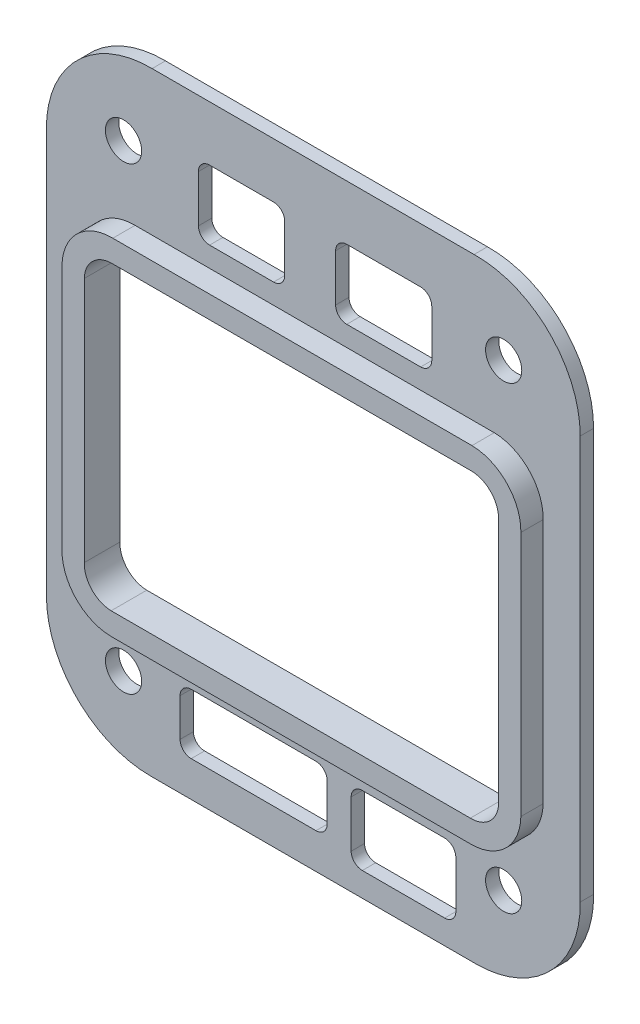
from build123d import *

# Parameters (mm, degrees)
MODEL_R         = 1.62599878
EXTRUDE_1_DEPTH = 1.2
EXTRUDE_2_DEPTH = 3.2


with BuildPart() as part:
    # Model → 凸台-拉伸1 (new body)
    with BuildSketch(Plane.XY):
        with BuildLine():
            Line((91.62866358, 91.6983307), (91.62866358, 55.46333332))
            ThreePointArc((91.62866358, 55.46333332), (94.371901783, 48.840435823), (100.99479928, 46.09719762))
            Line((100.99479928, 46.09719762), (130.2038036, 46.09719762))
            ThreePointArc((130.2038036, 46.09719762), (136.872269667, 48.885177471), (139.57079782, 55.59034094))
            Line((139.57079782, 55.59034094), (139.57079782, 91.83599362))
            ThreePointArc((139.57079782, 91.83599362), (136.765388235, 98.511299019), (130.03882044, 101.19146894))
            Line((130.03882044, 101.19146894), (101.12180182, 101.19146894))
            ThreePointArc((101.12180182, 101.19146894), (94.371333169, 98.448799351), (91.62866358, 91.6983307))
        make_face()
        with Locations((98.55639928, 53.0501987)):
            Circle(MODEL_R, mode=Mode.SUBTRACT)
        with BuildLine():
            ThreePointArc((104.632, 49.276), (103.924893219, 49.568893219), (103.632, 50.276))
            Line((103.632, 50.276), (103.632, 53.6735))
            ThreePointArc((103.632, 53.6735), (103.924893219, 54.380606781), (104.632, 54.6735))
            Line((104.632, 54.6735), (115.84, 54.6735))
            ThreePointArc((115.84, 54.6735), (116.547106781, 54.380606781), (116.84, 53.6735))
            Line((116.84, 53.6735), (116.84, 50.276))
            ThreePointArc((116.84, 50.276), (116.547106781, 49.568893219), (115.84, 49.276))
            Line((115.84, 49.276), (104.632, 49.276))
        make_face(mode=Mode.SUBTRACT)
        with BuildLine():
            ThreePointArc((119.999, 48.26), (119.291893219, 48.552893219), (118.999, 49.26))
            Line((118.999, 49.26), (118.999, 53.483))
            ThreePointArc((118.999, 53.483), (119.291893219, 54.190106781), (119.999, 54.483))
            Line((119.999, 54.483), (127.397, 54.483))
            ThreePointArc((127.397, 54.483), (128.104106781, 54.190106781), (128.397, 53.483))
            Line((128.397, 53.483), (128.397, 49.26))
            ThreePointArc((128.397, 49.26), (128.104106781, 48.552893219), (127.397, 48.26))
            Line((127.397, 48.26), (119.999, 48.26))
        make_face(mode=Mode.SUBTRACT)
        with Locations((132.69399928, 53.0501987)):
            Circle(MODEL_R, mode=Mode.SUBTRACT)
        with BuildLine():
            ThreePointArc((99.419126585, 57.181997458), (96.27876767, 58.553502055), (95.028, 61.743871815))
            Line((95.028, 61.743871815), (95.028, 83.841870988))
            ThreePointArc((95.028, 83.841870988), (96.399503395, 86.982228572), (99.58987085, 88.232997462))
            Line((99.58987085, 88.232997462), (131.847868221, 88.233000002))
            ThreePointArc((131.847868221, 88.233000002), (134.988140962, 86.861585383), (136.239, 83.671374948))
            Line((136.239, 83.671374948), (136.239, 61.573126472))
            ThreePointArc((136.239, 61.573126472), (134.867496605, 58.432768888), (131.67712915, 57.181999998))
            Line((131.67712915, 57.181999998), (99.419126585, 57.181997458))
        make_face(mode=Mode.SUBTRACT)
        with Locations((98.55639928, 94.2997987)):
            Circle(MODEL_R, mode=Mode.SUBTRACT)
        with BuildLine():
            ThreePointArc((106.283, 90.043), (105.575893219, 90.335893219), (105.283, 91.043))
            Line((105.283, 91.043), (105.283, 95.266))
            ThreePointArc((105.283, 95.266), (105.575893219, 95.973106781), (106.283, 96.266))
            Line((106.283, 96.266), (112.03, 96.266))
            ThreePointArc((112.03, 96.266), (112.737106781, 95.973106781), (113.03, 95.266))
            Line((113.03, 95.266), (113.03, 91.043))
            ThreePointArc((113.03, 91.043), (112.737106781, 90.335893219), (112.03, 90.043))
            Line((112.03, 90.043), (106.283, 90.043))
        make_face(mode=Mode.SUBTRACT)
        with BuildLine():
            ThreePointArc((117.602, 95.266), (117.894893219, 95.973106781), (118.602, 96.266))
            Line((118.602, 96.266), (125.238, 96.266))
            ThreePointArc((125.238, 96.266), (125.945106781, 95.973106781), (126.238, 95.266))
            Line((126.238, 95.266), (126.238, 91.043))
            ThreePointArc((126.238, 91.043), (125.945106781, 90.335893219), (125.238, 90.043))
            Line((125.238, 90.043), (118.602, 90.043))
            ThreePointArc((118.602, 90.043), (117.894893219, 90.335893219), (117.602, 91.043))
            Line((117.602, 91.043), (117.602, 95.266))
        make_face(mode=Mode.SUBTRACT)
        with Locations((132.69399928, 94.2997987)):
            Circle(MODEL_R, mode=Mode.SUBTRACT)
    extrude(amount=EXTRUDE_1_DEPTH)

    # Model<4> → 凸台-拉伸2 (add)
    with BuildSketch(Plane.XY):
        with BuildLine():
            Line((95.028, 83.841870988), (95.028, 61.743871815))
            ThreePointArc((95.028, 61.743871815), (96.27876767, 58.553502055), (99.419126585, 57.181997458))
            Line((99.419126585, 57.181997458), (131.67712915, 57.181999998))
            ThreePointArc((131.67712915, 57.181999998), (134.867496605, 58.432768888), (136.239, 61.573126472))
            Line((136.239, 61.573126472), (136.239, 83.671374948))
            ThreePointArc((136.239, 83.671374948), (134.988140962, 86.861585383), (131.847868221, 88.233000002))
            Line((131.847868221, 88.233000002), (99.58987085, 88.232997462))
            ThreePointArc((99.58987085, 88.232997462), (96.399503395, 86.982228572), (95.028, 83.841870988))
        make_face()
        with BuildLine():
            Line((134.239, 83.69318288), (134.239, 61.59499746))
            ThreePointArc((134.239, 61.59499746), (133.468748117, 59.862447526), (131.699, 59.182))
            Line((131.699, 59.182), (99.44099746, 59.18199746))
            ThreePointArc((99.44099746, 59.18199746), (97.708446609, 59.952250241), (97.028, 61.722))
            Line((97.028, 61.722), (97.028, 83.82))
            ThreePointArc((97.028, 83.82), (97.798251883, 85.552549934), (99.568, 86.23299746))
            Line((99.568, 86.23299746), (131.82599746, 86.233))
            ThreePointArc((131.82599746, 86.233), (133.558484649, 85.46281457), (134.239, 83.69318288))
        make_face(mode=Mode.SUBTRACT)
    extrude(amount=EXTRUDE_2_DEPTH)


solid = part.part
